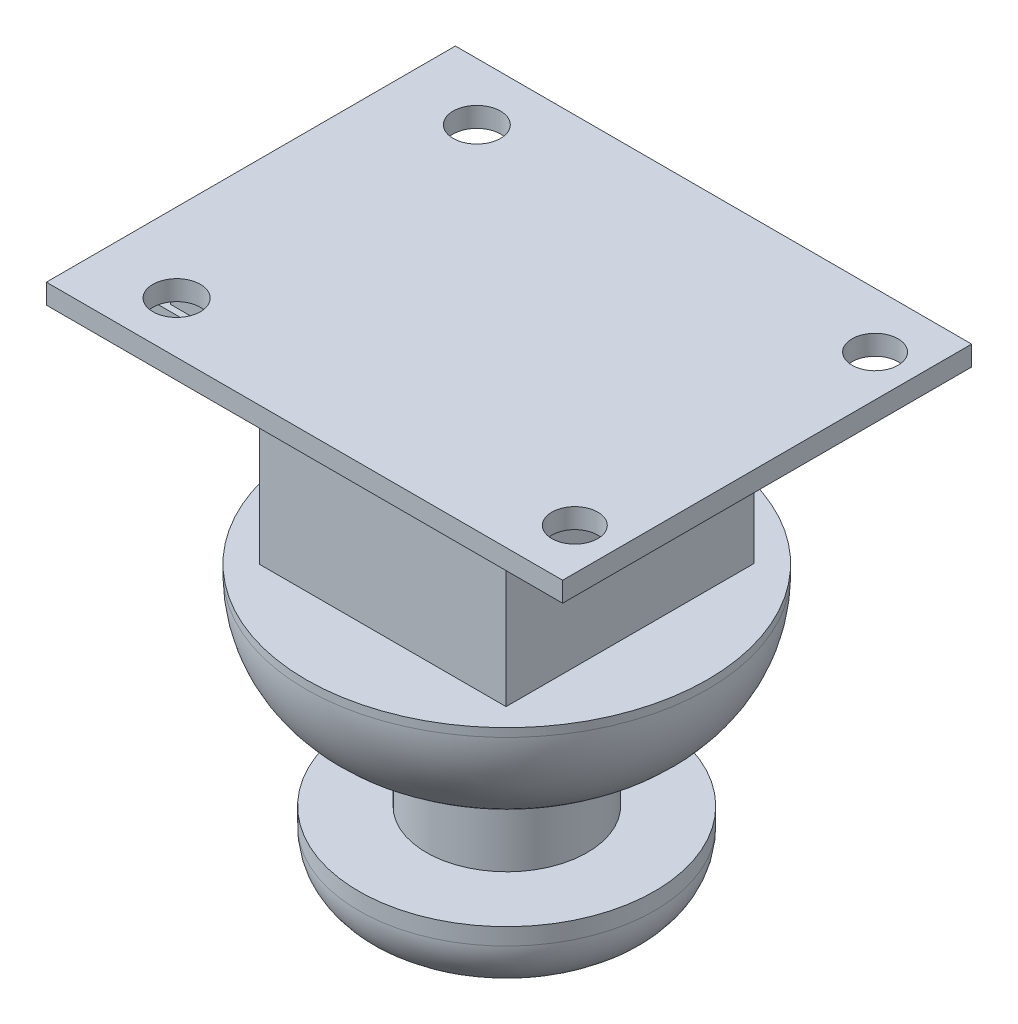
from build123d import *

# Parameters (mm, degrees)
SKETCH_1_W      = 33.7
SKETCH_1_H      = 26.7
SKETCH_1_R      = 1.500160794
SKETCH_1_R_2    = 1.5
SKETCH_1_R_3    = 1.552324123
SKETCH_1_R_4    = 1.546482565
EXTRUDE_1_DEPTH = 1.3
SKETCH_2_W      = 2.597810981
SKETCH_2_H      = 12.596422695
EXTRUDE_3_DEPTH = 2.6
SKETCH_3_W      = 0.801502227
SKETCH_3_H      = 0.800416217
SKETCH_3_H_2    = 0.802091773
SKETCH_3_H_3    = 0.798469443
SKETCH_3_H_4    = 0.802947908
SKETCH_3_H_5    = 0.804334784
SKETCH_6_W      = 16.101670469
SKETCH_6_H      = 16.19878198
EXTRUDE_4_DEPTH = 12.4
SKETCH_7_R      = 13.101940721
EXTRUDE_5_DEPTH = 8.4
FILLET_1_R      = 7.85
SKETCH_9_R      = 5.251940721
EXTRUDE_6_DEPTH = 5.3
SKETCH_12_R     = 9.651169133
EXTRUDE_8_DEPTH = 4.6
FILLET_2_R      = 3.5


with BuildPart() as part:
    # Эскиз1 → Бобышка-Вытянуть1 (new body)
    with BuildSketch(Plane(origin=(0, 0, 0), x_dir=(1, 0, 0), z_dir=(0, 1, 0))):
        with Locations((16.85, 13.35)):
            Rectangle(SKETCH_1_W, SKETCH_1_H)
        with Locations(Location((30.998263896, 3.498646338, 0), (0, 0, 270))):
            Circle(SKETCH_1_R, mode=Mode.SUBTRACT)
        with Locations(Location((30.998263896, 23.098469173, 0), (0, 0, 270))):
            Circle(SKETCH_1_R_2, mode=Mode.SUBTRACT)
        with Locations(Location((5.150482455, 3.352746683, 0), (0, 0, 270))):
            Circle(SKETCH_1_R_3, mode=Mode.SUBTRACT)
        with Locations(Location((5.150482455, 22.950000581, 0), (0, 0, 270))):
            Circle(SKETCH_1_R_4, mode=Mode.SUBTRACT)
    extrude(amount=EXTRUDE_1_DEPTH)

    # Эскиз2 → Бобышка-Вытянуть3 (add)
    with BuildSketch(Plane.XZ):
        with Locations((2.697533257, -12.993800664)):
            Rectangle(SKETCH_2_W, SKETCH_2_H)
    extrude(amount=EXTRUDE_3_DEPTH)

    # По траектории3: sweep along a path in Эскиз4
    with BuildLine(Plane.XY) as sweep_3_path:
        Line((2.697117024, -2.6), (2.697117024, -3.4))
        ThreePointArc((2.697117024, -3.4), (2.404223805, -4.107106781), (1.697117024, -4.4))
        Line((1.697117024, -4.4), (-4.903035907, -4.4))
    # Эскиз3 → По траектории3 (sweep)
    with BuildSketch(Plane.XZ.offset(2.6)):
        with Locations((2.697117024, -18.090816879)):
            Rectangle(SKETCH_3_W, SKETCH_3_H)
        with Locations((2.697117024, -15.69317288)):
            Rectangle(SKETCH_3_W, SKETCH_3_H_2)
        with Locations((2.697117024, -13.090941171)):
            Rectangle(SKETCH_3_W, SKETCH_3_H_3)
        with Locations((2.697117024, -10.688983068)):
            Rectangle(SKETCH_3_W, SKETCH_3_H_4)
        with Locations((2.697117024, -8.082021693)):
            Rectangle(SKETCH_3_W, SKETCH_3_H_5)
    sweep(path=sweep_3_path.line)

    # Эскиз6 → Бобышка-Вытянуть4 (add)
    with BuildSketch(Plane.XZ):
        with Locations((17.251381143, -12.805593049)):
            Rectangle(SKETCH_6_W, SKETCH_6_H)
    extrude(amount=EXTRUDE_4_DEPTH)

    # Эскиз7 → Бобышка-Вытянуть5 (add)
    with BuildSketch(Plane.XZ.offset(12.4)):
        with Locations(Location((17.251381142, -12.805593049, 0), (0, 0, 270))):
            Circle(SKETCH_7_R)
    extrude(amount=EXTRUDE_5_DEPTH)

    # Скругление1
    fillet_1_edges = [part.edges().sort_by_distance(p)[0] for p in [
        (17.251381142, -20.8, 0.296347672),
    ]]
    fillet(fillet_1_edges, radius=FILLET_1_R)

    # Эскиз9 → Бобышка-Вытянуть6 (add)
    with BuildSketch(Plane.XZ.offset(20.8)):
        with Locations(Location((17.251381142, -12.805593049, 0), (0, 0, 270))):
            Circle(SKETCH_9_R)
    extrude(amount=EXTRUDE_6_DEPTH)

    # Эскиз12 → Бобышка-Вытянуть8 (add)
    with BuildSketch(Plane.XZ.offset(26.1)):
        with Locations(Location((17.236348133, -12.810976669, 0), (0, 0, 270))):
            Circle(SKETCH_12_R)
    extrude(amount=EXTRUDE_8_DEPTH)

    # Скругление2
    fillet_2_edges = [part.edges().sort_by_distance(p)[0] for p in [
        (17.236348133, -30.7, -3.159807536),
    ]]
    fillet(fillet_2_edges, radius=FILLET_2_R)


solid = part.part
